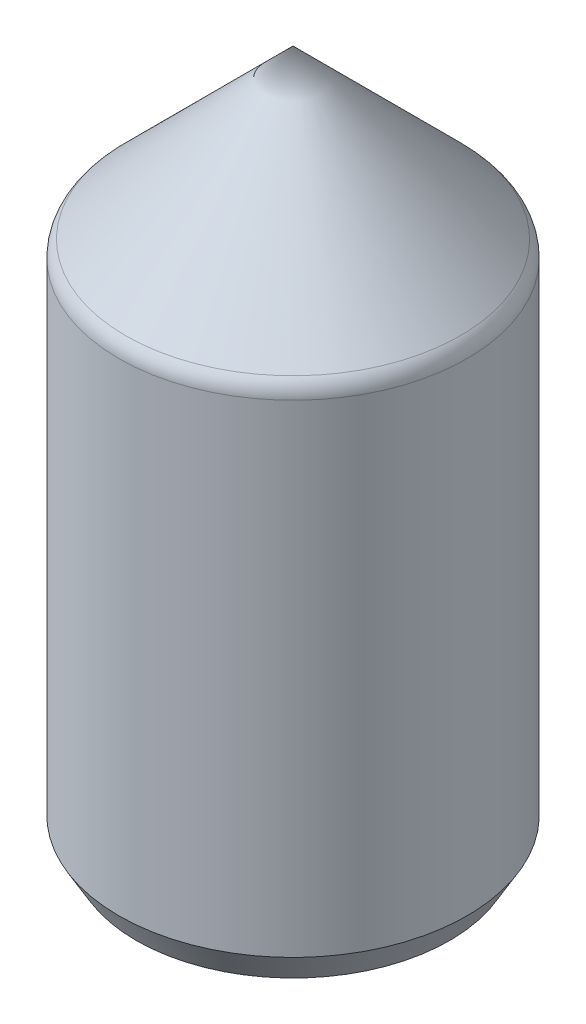
from build123d import *

# Parameters (mm, degrees)
FILLET1_R               = 0.2
CUT_EXTRUDE1_DEPTH      = 7.363961172
CUT_EXTRUDE1_DEPTH_BACK = 2.1
CHAMFER1_SIZE           = 0.15
CHAMFER1_SIZE2          = 0.259807621


with BuildPart() as part:
    # Sketch1 → Revolve1 (revolve)
    with BuildSketch(Plane.XY, mode=Mode.PRIVATE) as revolve1_sk:
        Polygon((1.5, 4.5), (0, 6), (0, 3.478320035), (0, 0), (1.5, 0), align=None)
    revolve(revolve1_sk.sketch.rotate(Axis((0, 6, 0), (0, -1, 0)), 270), axis=Axis((0, 6, 0), (0, -1, 0)))

    # Fillet1
    fillet1_edges = [part.edges().sort_by_distance(p)[0] for p in [
        (0, 4.5, 1.5),
    ]]
    fillet(fillet1_edges, radius=FILLET1_R)

    # Sketch2 → Cut-Extrude1 (cut, two sides: drawn at the far end of the back side and taken through both)
    with BuildSketch(Plane.XZ.offset(-CUT_EXTRUDE1_DEPTH_BACK)):
        Polygon((0, 0.866025404), (-0.75, 0.433012702), (-0.75, -0.433012702), (0, -0.866025404), (0.75, -0.433012702), (0.75, 0.433012702), align=None)
    extrude(amount=CUT_EXTRUDE1_DEPTH + CUT_EXTRUDE1_DEPTH_BACK, mode=Mode.SUBTRACT)

    # Chamfer1
    chamfer1_edges = [part.edges().sort_by_distance(p)[0] for p in [
        (0, 0, 1.5),
    ]]
    chamfer1_side = [part.faces().sort_by_distance(p)[0] for p in [
        (0, 0, 1.457573593),
    ]]
    chamfer(chamfer1_edges, length=CHAMFER1_SIZE, length2=CHAMFER1_SIZE2, reference=chamfer1_side[0])


solid = part.part
